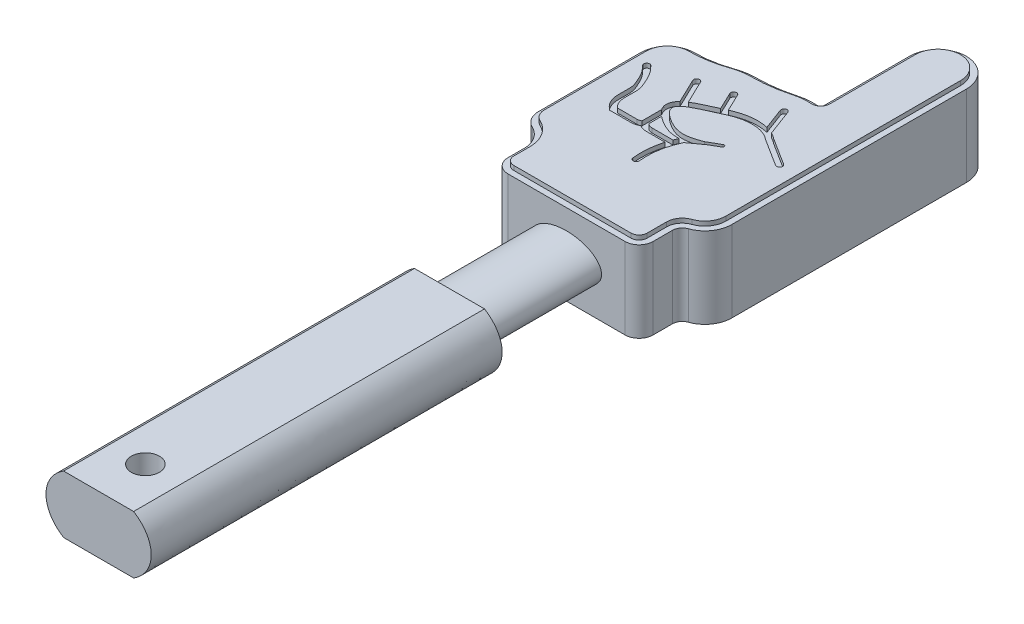
from build123d import *

# Parameters (mm, degrees)
BOSS_EXTRU_1_DEPTH  = 14.6
CUT_EXTRUDE1_DEPTH  = 0.75
CUT_EXTRUDE2_START  = -0.75
CUT_EXTRUDE2_DEPTH  = 0.75
SKETCH3_RX          = 6
SKETCH3_RY          = 3.5
BOSS_EXTRUDE1_DEPTH = 20
BOSS_EXTRUDE4_DEPTH = 60
SKETCH5_R           = 2.4
CUT_EXTRUDE3_DEPTH  = 504.89715206


with BuildPart() as part:
    # Esquisse2 → Boss.-Extru.1 (new body)
    with BuildSketch(Plane(origin=(0, 0, 0), x_dir=(1, 0, 0), z_dir=(0, 1, 0))):
        with BuildLine():
            Line((-461.351388226, 50.678431152), (-461.351388226, 90.775522892))
            ThreePointArc((-461.351388226, 90.775522892), (-466.211366791, 95.635501457), (-471.071345356, 90.775522892))
            Line((-471.071345356, 90.775522892), (-471.071345356, 76.175522892))
            ThreePointArc((-471.071345356, 76.175522892), (-471.248130994, 75.769164395), (-471.66594897, 75.621487285))
            ThreePointArc((-471.66594897, 75.621487285), (-473.268553235, 75.597795011), (-474.843817202, 75.302083679))
            ThreePointArc((-474.843817202, 75.302083679), (-477.875381422, 74.67740473), (-480.963538252, 74.467898632))
            ThreePointArc((-480.963538252, 74.467898632), (-482.600253942, 74.327779354), (-484.189336279, 73.911499414))
            ThreePointArc((-484.189336279, 73.911499414), (-487.044689997, 73.163503891), (-489.985634038, 72.911729587))
            ThreePointArc((-489.985634038, 72.911729587), (-493.246058953, 71.561217368), (-494.596571172, 68.300792453))
            Line((-494.596571172, 68.300792453), (-494.596571172, 50.839303584))
            ThreePointArc((-494.596571172, 50.839303584), (-494.110289111, 49.166185675), (-492.802956825, 48.014371421))
            ThreePointArc((-492.802956825, 48.014371421), (-491.037015464, 46.458503449), (-490.380146806, 44.198459732))
            Line((-490.380146806, 44.198459732), (-490.380146806, 41.432618273))
            ThreePointArc((-490.380146806, 41.432618273), (-489.677889469, 39.737219085), (-487.982490281, 39.034961748))
            Line((-487.982490281, 39.034961748), (-467.962472456, 39.034961748))
            ThreePointArc((-467.962472456, 39.034961748), (-466.267073268, 39.737219085), (-465.564815931, 41.432618273))
            Line((-465.564815931, 41.432618273), (-465.564815931, 44.736417722))
            ThreePointArc((-465.564815931, 44.736417722), (-465.25323649, 45.714489805), (-464.433325852, 46.332108859))
            ThreePointArc((-464.433325852, 46.332108859), (-462.200064163, 48.014371421), (-461.351388226, 50.678431152))
        make_face()
    extrude(amount=BOSS_EXTRU_1_DEPTH)

    # Esquisse4 → Cut-Extrude1 (cut)
    with BuildSketch(Plane(origin=(0, 14.6, 0), x_dir=(1, 0, 0), z_dir=(0, 1, 0))):
        with BuildLine():
            Line((-470.759038399, 66.876254444), (-472.431256119, 71.341307125))
            ThreePointArc((-472.431256119, 71.341307125), (-473.074857274, 71.634185177), (-473.367735327, 70.990584023))
            Line((-473.367735327, 70.990584023), (-471.993157719, 67.320271624))
            add(Edge.make_bspline(
                [(-471.993157719, 67.320271624), (-472.180478604, 67.36498208), (-473.344002436, 67.587235479), (-475.479739271, 67.472490346), (-477.043546697, 66.90883882), (-477.828675922, 66.569064368)],
                knots=[0.068797937, 0.068797937, 0.068797937, 0.068797937, 0.085212198, 0.170424395, 0.255222354, 0.255222354, 0.255222354, 0.255222354], degree=3))
            Line((-477.828675922, 66.569064368), (-479.267266322, 69.577025126))
            ThreePointArc((-479.267266322, 69.577025126), (-479.934061212, 69.812364403), (-480.169400489, 69.145569513))
            Line((-480.169400489, 69.145569513), (-478.739708759, 66.156215062))
            add(Edge.make_bspline(
                [(-478.739708759, 66.156215062), (-478.841024014, 66.108993774), (-479.354480109, 65.868730534), (-480.336105389, 65.411150949), (-481.572356528, 64.836708033), (-482.243555734, 64.447144423), (-482.434113402, 64.325134018)],
                knots=[0.287644358, 0.287644358, 0.287644358, 0.287644358, 0.298242692, 0.340848791, 0.38345489, 0.401256901, 0.401256901, 0.401256901, 0.401256901], degree=3))
            Line((-482.434113402, 64.325134018), (-484.376696119, 68.359024433))
            ThreePointArc((-484.376696119, 68.359024433), (-485.044120706, 68.592571896), (-485.277668173, 67.92514731))
            Line((-485.277668173, 67.92514731), (-483.244253147, 63.702638116))
            add(Edge.make_bspline(
                [(-483.244253147, 63.702638116), (-483.418919034, 63.535954123), (-483.760315122, 63.142157659), (-484.042020949, 62.414395148), (-483.98092589, 61.705227649), (-483.81969142, 61.284857812), (-483.685609155, 61.05413183), (-483.620520673, 60.956427528)],
                knots=[0.428301618, 0.428301618, 0.428301618, 0.428301618, 0.447364038, 0.468667087, 0.479318612, 0.489970137, 0.498689123, 0.498689123, 0.498689123, 0.498689123], degree=3))
            Line((-483.620520673, 60.956427528), (-483.620520673, 57.597881669))
            ThreePointArc((-483.620520673, 57.597881669), (-483.937770251, 57.455882294), (-484.281674888, 57.405476759))
            Line((-484.281674888, 57.405476759), (-487.605186099, 57.405476759))
            add(Edge.make_bspline(
                [(-490.458271221, 65.889651605), (-489.964259208, 65.347801564), (-489.257587251, 64.008444797), (-488.043116631, 61.175336728), (-489.057887679, 58.585169194), (-487.605186099, 57.405476759)],
                knots=[0, 0, 0, 0, 0.249547348, 0.474449153, 1, 1, 1, 1], degree=3))
            Line((-490.458271221, 65.889651605), (-491.048066053, 66.536559667))
            ThreePointArc((-491.048066053, 66.536559667), (-491.754419993, 66.569180401), (-491.787040726, 65.862826461))
            Line((-491.787040726, 65.862826461), (-491.197245894, 65.215918399))
            add(Edge.make_bspline(
                [(-491.197245894, 65.215918399), (-491.095097262, 65.103878105), (-490.913977468, 64.874895205), (-490.547291291, 64.301678952), (-490.112893659, 63.432242493), (-489.67204398, 62.416186706), (-489.504878635, 61.586502311), (-489.545778679, 60.45666192), (-489.577909133, 59.345919755), (-489.409307696, 58.369978179), (-489.164894876, 57.743514674), (-488.855110289, 57.261917218), (-488.580019374, 56.929642688), (-488.203701982, 56.597390566), (-488.049329474, 56.477953416), (-487.960080001, 56.405476808)],
                knots=[0, 0, 0, 0, 0.06457641, 0.129152819, 0.258305639, 0.387458458, 0.516611277, 0.645764097, 0.774916916, 0.839493325, 0.904069735, 0.93635794, 0.968646145, 1.00093435, 1.033222554, 1.033222554, 1.033222554, 1.033222554], degree=3))
            Line((-487.960080001, 56.405476808), (-484.27830747, 56.405476808))
            ThreePointArc((-484.27830747, 56.405476808), (-483.619158654, 56.507503464), (-483.018252357, 56.796982689))
            ThreePointArc((-483.018252357, 56.796982689), (-482.407788066, 56.505542911), (-481.738765966, 56.405476808))
            Line((-481.738765966, 56.405476808), (-478.488031211, 56.405476808))
            ThreePointArc((-478.488031211, 56.405476808), (-478.957737586, 53.904962522), (-478.929991667, 51.360866232))
            ThreePointArc((-478.929991667, 51.360866232), (-478.378479008, 50.918335117), (-477.935947893, 51.469847775))
            ThreePointArc((-477.935947893, 51.469847775), (-477.83656682, 54.786935808), (-476.829735496, 57.949093346))
            add(Edge.make_bspline(
                [(-474.508389009, 59.630573263), (-475.39957607, 58.974494681), (-476.829735496, 57.949093346)],
                knots=[0.955294065, 0.955294065, 0.955294065, 1, 1, 1], degree=2))
            Line((-474.508389009, 59.630573263), (-472.899170253, 60.555580278))
            ThreePointArc((-472.899170253, 60.555580278), (-472.798739907, 60.927560405), (-473.170720034, 61.027990752))
            Line((-473.170720034, 61.027990752), (-475.200560004, 59.861203335))
            add(Edge.make_bspline(
                [(-470.402527361, 65.460857516), (-471.656956737, 66.515168583), (-475.322492763, 66.806340084), (-478.871859969, 64.906936953), (-484.363975035, 62.557505369), (-480.712618445, 59.603798607), (-478.225902463, 58.808845566), (-475.900969447, 59.583081624), (-475.200560004, 59.861203335)],
                knots=[0, 0, 0, 0, 0.16361185, 0.327509924, 0.477241817, 0.563600697, 0.697734382, 0.765481354, 0.765481354, 0.765481354, 0.765481354], degree=3))
            ThreePointArc((-470.402527361, 65.460857516), (-470.39519915, 65.413665236), (-470.34800687, 65.420993448))
            Line((-470.34800687, 65.420993448), (-465.618535182, 62.431067479))
            ThreePointArc((-465.618535182, 62.431067479), (-464.928726258, 62.586514085), (-465.084172863, 63.27632301))
            Line((-465.084172863, 63.27632301), (-469.785886114, 66.248700365))
            add(Edge.make_bspline(
                [(-469.785886114, 66.248700365), (-470.08228622, 66.493908564), (-470.414152153, 66.704476344), (-470.759038399, 66.876254444)],
                knots=[0.000946473, 0.000946473, 0.000946473, 0.000946473, 0.032279754, 0.032279754, 0.032279754, 0.032279754], degree=3))
        make_face()
        with BuildLine():
            ThreePointArc((-477.834269574, 58.161899431), (-477.998837916, 57.786197293), (-478.151437751, 57.405476759))
            Line((-478.151437751, 57.405476759), (-481.738765966, 57.405476759))
            ThreePointArc((-481.738765966, 57.405476759), (-482.213049829, 57.496092802), (-482.620520673, 57.755175725))
            Line((-482.620520673, 57.755175725), (-482.620520673, 59.923424064))
            add(Edge.make_bspline(
                [(-482.620520673, 59.923424064), (-482.437562835, 59.77785948), (-481.806793393, 59.321946019), (-480.7515692, 58.705977162), (-479.366332949, 58.209178182), (-478.336605496, 58.132512954), (-477.834269574, 58.161899431)],
                knots=[0.535685582, 0.535685582, 0.535685582, 0.535685582, 0.553879285, 0.596485384, 0.639091483, 0.681697582, 0.681697582, 0.681697582, 0.681697582], degree=3))
        make_face(mode=Mode.SUBTRACT)
    extrude(amount=-CUT_EXTRUDE1_DEPTH, mode=Mode.SUBTRACT)

    # Sketch1 → Cut-Extrude2 (cut)
    with BuildSketch(Plane(origin=(0, 14.6, 0), x_dir=(1, 0, 0), z_dir=(0, 1, 0)).offset(CUT_EXTRUDE2_START)):
        with BuildLine():
            Line((-461.351388226, 50.678431152), (-461.351388226, 90.775522892))
            ThreePointArc((-461.351388226, 90.775522892), (-466.211366791, 95.635501457), (-471.071345356, 90.775522892))
            Line((-471.071345356, 90.775522892), (-471.071345356, 76.175522892))
            ThreePointArc((-471.071345356, 76.175522892), (-471.248130994, 75.769164395), (-471.66594897, 75.621487285))
            ThreePointArc((-471.66594897, 75.621487285), (-473.268553235, 75.597795011), (-474.843817202, 75.302083679))
            ThreePointArc((-474.843817202, 75.302083679), (-477.875381422, 74.67740473), (-480.963538252, 74.467898632))
            ThreePointArc((-480.963538252, 74.467898632), (-482.600253942, 74.327779354), (-484.189336279, 73.911499414))
            ThreePointArc((-484.189336279, 73.911499414), (-487.044689997, 73.163503891), (-489.985634038, 72.911729587))
            ThreePointArc((-489.985634038, 72.911729587), (-493.246058953, 71.561217368), (-494.596571172, 68.300792453))
            Line((-494.596571172, 68.300792453), (-494.596571172, 50.839303584))
            ThreePointArc((-494.596571172, 50.839303584), (-494.110289111, 49.166185675), (-492.802956825, 48.014371421))
            ThreePointArc((-492.802956825, 48.014371421), (-491.037015464, 46.458503449), (-490.380146806, 44.198459732))
            Line((-490.380146806, 44.198459732), (-490.380146806, 41.432618273))
            ThreePointArc((-490.380146806, 41.432618273), (-489.677889469, 39.737219085), (-487.982490281, 39.034961748))
            Line((-487.982490281, 39.034961748), (-467.962472456, 39.034961748))
            ThreePointArc((-467.962472456, 39.034961748), (-466.267073268, 39.737219085), (-465.564815931, 41.432618273))
            Line((-465.564815931, 41.432618273), (-465.564815931, 44.736417722))
            ThreePointArc((-465.564815931, 44.736417722), (-465.25323649, 45.714489805), (-464.433325852, 46.332108859))
            ThreePointArc((-464.433325852, 46.332108859), (-462.200064163, 48.014371421), (-461.351388226, 50.678431152))
        make_face()
        with BuildLine():
            Line((-462.351388226, 50.678431152), (-462.351388226, 90.775522892))
            ThreePointArc((-462.351388226, 90.775522892), (-466.211366791, 94.635501457), (-470.071345356, 90.775522892))
            Line((-470.071345356, 90.775522892), (-470.071345356, 76.175522892))
            ThreePointArc((-470.071345356, 76.175522892), (-470.566423079, 75.037539957), (-471.736497608, 74.623978944))
            ThreePointArc((-471.736497608, 74.623978944), (-473.168548328, 74.602808068), (-474.576168379, 74.338567147))
            ThreePointArc((-474.576168379, 74.338567147), (-477.740319459, 73.686567576), (-480.963538252, 73.467898632))
            ThreePointArc((-480.963538252, 73.467898632), (-482.430279639, 73.342330859), (-483.854334437, 72.969281942))
            ThreePointArc((-483.854334437, 72.969281942), (-486.874715694, 72.178055396), (-489.985634038, 71.911729587))
            ThreePointArc((-489.985634038, 71.911729587), (-492.538952172, 70.854110587), (-493.596571172, 68.300792453))
            Line((-493.596571172, 68.300792453), (-493.596571172, 50.839303584))
            ThreePointArc((-493.596571172, 50.839303584), (-493.266077191, 49.702195222), (-492.377569295, 48.919382719))
            ThreePointArc((-492.377569295, 48.919382719), (-490.192803545, 46.994512997), (-489.380146806, 44.198459732))
            Line((-489.380146806, 44.198459732), (-489.380146806, 41.432618273))
            ThreePointArc((-489.380146806, 41.432618273), (-488.970782687, 40.444325866), (-487.982490281, 40.034961748))
            Line((-487.982490281, 40.034961748), (-467.962472456, 40.034961748))
            ThreePointArc((-467.962472456, 40.034961748), (-466.974180049, 40.444325866), (-466.564815931, 41.432618273))
            Line((-466.564815931, 41.432618273), (-466.564815931, 44.736417722))
            ThreePointArc((-466.564815931, 44.736417722), (-466.068969381, 46.292918583), (-464.764166151, 47.275795616))
            ThreePointArc((-464.764166151, 47.275795616), (-463.015797054, 48.592800198), (-462.351388226, 50.678431152))
        make_face(mode=Mode.SUBTRACT)
    extrude(amount=CUT_EXTRUDE2_DEPTH, mode=Mode.SUBTRACT)

    # Sketch3 → Boss-Extrude1 (add)
    with BuildSketch(Plane.XY.offset(-39.034961748)):
        with Locations(Location((-477.982490281, 6.925), (0, 0, 180))):
            Ellipse(SKETCH3_RX, SKETCH3_RY)
    extrude(amount=BOSS_EXTRUDE1_DEPTH)

    # Sketch4 → Boss-Extrude4 (add)
    with BuildSketch(Plane.XY.offset(-19.034961748)):
        with BuildLine():
            Line((-471.994840072, 11.85), (-483.970178631, 11.85))
            add(Edge.make_bspline(
                [(-483.970178631, 11.85), (-484.146463568, 11.73943682), (-484.318962354, 11.622063152), (-484.694154812, 11.343645375), (-484.894356027, 11.178778057), (-485.460283405, 10.657699436), (-485.79641213, 10.272291521), (-486.367924923, 9.408402691), (-486.590784158, 8.947891136), (-486.821075127, 8.218065888), (-486.880814145, 7.966285581), (-486.961231134, 7.45474552), (-487.001810503, 6.94337717), (-486.964973793, 6.432342506), (-486.88855352, 5.921478458), (-486.830420573, 5.667713278), (-486.679268412, 5.177160617), (-486.585974303, 4.938296786), (-486.365202959, 4.472940664), (-486.236969437, 4.245730718), (-485.954784184, 3.815209856), (-485.800219176, 3.610303864), (-485.466325466, 3.219524458), (-485.285913302, 3.032709898), (-484.747000867, 2.533865269), (-484.369837195, 2.250579447), (-483.970192513, 2)],
                knots=[0.377912619, 0.377912619, 0.377912619, 0.377912619, 0.390625, 0.390625, 0.40625, 0.40625, 0.4375, 0.4375, 0.46875, 0.46875, 0.484375, 0.484375, 0.5, 0.515625, 0.515625, 0.53125, 0.53125, 0.546875, 0.546875, 0.5625, 0.5625, 0.578125, 0.578125, 0.59375, 0.59375, 0.622582638, 0.622582638, 0.622582638, 0.622582638], degree=3))
            Line((-483.970192513, 2), (-471.994785835, 2))
            add(Edge.make_bspline(
                [(-471.994785835, 2), (-471.597697507, 2.248977611), (-471.223818797, 2.529667159), (-470.688817555, 3.023049838), (-470.507541394, 3.209956583), (-470.17278255, 3.600124803), (-470.018201014, 3.804226138), (-469.595543455, 4.445479544), (-469.367049471, 4.918847405), (-469.139139852, 5.650156748), (-469.081193451, 5.898624701), (-469.00282443, 6.40534192), (-468.982490281, 6.665472062), (-468.982490281, 7.444055877), (-469.061287039, 7.949309524), (-469.291050276, 8.687647458), (-469.386628728, 8.929721259), (-469.608104875, 9.39251487), (-469.734575295, 9.615247027), (-470.017150774, 10.044389948), (-470.17430209, 10.251824341), (-470.509763405, 10.642453127), (-470.688426478, 10.8265209), (-471.220371527, 11.317278206), (-471.599348325, 11.601812517), (-471.994840072, 11.85)],
                knots=[0.877676667, 0.877676667, 0.877676667, 0.877676667, 0.90625, 0.90625, 0.921875, 0.921875, 0.9375, 0.9375, 0.96875, 0.96875, 0.984375, 0.984375, 1, 1, 1.03125, 1.03125, 1.046875, 1.046875, 1.0625, 1.0625, 1.078125, 1.078125, 1.09375, 1.09375, 1.122213385, 1.122213385, 1.122213385, 1.122213385], degree=3))
        make_face()
    extrude(amount=BOSS_EXTRUDE4_DEPTH)

    # Sketch5 → Cut-Extrude3 (cut, through all)
    with BuildSketch(Plane(origin=(0, 11.85, 0), x_dir=(1, 0, 0), z_dir=(0, 1, 0))):
        with Locations(Location((-477.982509352, -32.965038252, 0), (0, 0, 180))):
            Circle(SKETCH5_R)
    extrude(amount=-CUT_EXTRUDE3_DEPTH, mode=Mode.SUBTRACT)


solid = part.part
